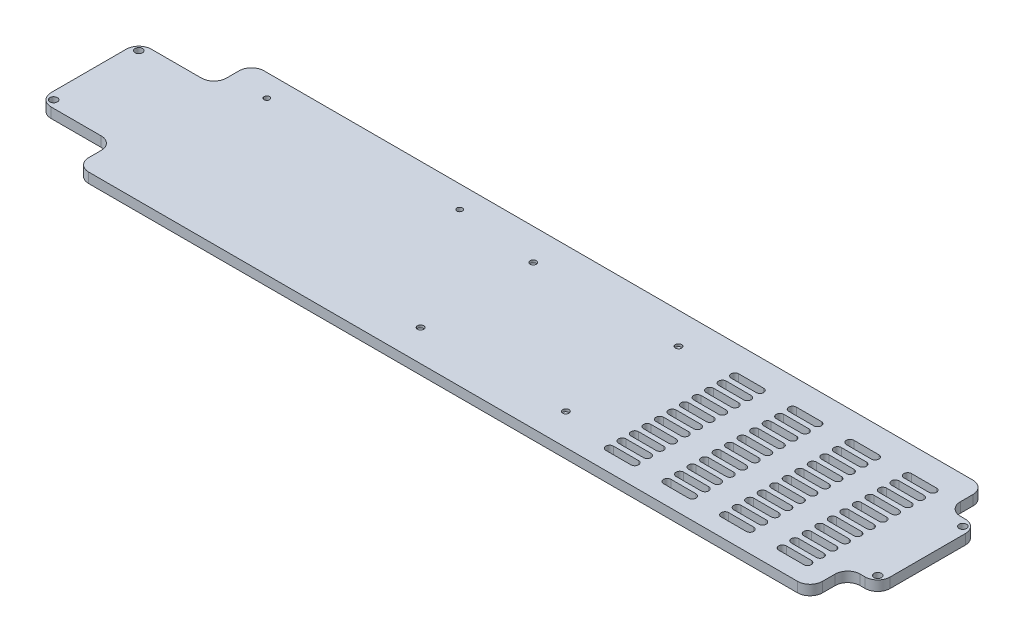
from build123d import *

# Parameters (mm, degrees)
SKETCH1_W            = 335
SKETCH1_H            = 70
EXTRUDE1_DEPTH       = 4
SKETCH2_W            = 30
SKETCH2_H            = 15
SKETCH2_W_2          = 12
EXTRUDE2_DEPTH       = 185.306017615
SKETCH4_R            = 1.1
EXTRUDE4_DEPTH       = 185.306017615
SKETCH5_R            = 1.25
EXTRUDE5_DEPTH       = 1
EXTRUDE6_DEPTH       = 185.306017615
LPATTERN1_COUNT      = 11
LPATTERN1_PITCH      = 5
LPATTERN1_COUNT_DIR2 = 4
LPATTERN1_PITCH_DIR2 = 23
FILLET1_R            = 5
SKETCH7_R            = 1.5
EXTRUDE7_DEPTH       = 185.306017615


with BuildPart() as part:
    # Sketch1 → Extrude1 (new body)
    with BuildSketch(Plane(origin=(0, 0, 0), x_dir=(1, 0, 0), z_dir=(0, 1, 0))):
        with Locations((12.647057132, 3.726553367)):
            Rectangle(SKETCH1_W, SKETCH1_H)
    extrude(amount=EXTRUDE1_DEPTH)

    # Sketch2 → Extrude2 (cut, through all)
    with BuildSketch(Plane(origin=(0, 4, 0), x_dir=(1, 0, 0), z_dir=(0, 1, 0))):
        with Locations((-139.852942868, 31.226553367)):
            Rectangle(SKETCH2_W, SKETCH2_H)
        with Locations((-139.852942868, -23.773446633)):
            Rectangle(SKETCH2_W, SKETCH2_H)
        with Locations((174.147057132, 31.226553367)):
            Rectangle(SKETCH2_W_2, SKETCH2_H)
        with Locations((174.147057132, -23.773446633)):
            Rectangle(SKETCH2_W_2, SKETCH2_H)
    extrude(amount=-EXTRUDE2_DEPTH, mode=Mode.SUBTRACT)

    # Sketch4 → Extrude4 (cut, through all)
    with BuildSketch(Plane(origin=(0, 4, 0), x_dir=(1, 0, 0), z_dir=(0, 1, 0))):
        with Locations(Location((-109.852942868, 29.826553367, 0), (0, 0, 270))):
            Circle(SKETCH4_R)
        with Locations(Location((-32.852942868, 29.826553367, 0), (0, 0, 270))):
            Circle(SKETCH4_R)
    extrude(amount=-EXTRUDE4_DEPTH, mode=Mode.SUBTRACT)

    # Sketch5 → Extrude5 (cut)
    with BuildSketch(Plane(origin=(0, 4, 0), x_dir=(1, 0, 0), z_dir=(0, 1, 0))):
        with Locations(Location((0.147057132, 26.226553367, 0), (0, 0, 270))):
            Circle(SKETCH5_R)
        with Locations(Location((0.147057132, -18.773446633, 0), (0, 0, 270))):
            Circle(SKETCH5_R)
        with Locations(Location((58.147057132, 26.226553367, 0), (0, 0, 270))):
            Circle(SKETCH5_R)
        with Locations(Location((58.147057132, -18.773446633, 0), (0, 0, 270))):
            Circle(SKETCH5_R)
    extrude(amount=-EXTRUDE5_DEPTH, mode=Mode.SUBTRACT)

    # Sketch6 → Extrude6 (cut, through all)
    with BuildSketch(Plane(origin=(0, 4, 0), x_dir=(1, 0, 0), z_dir=(0, 1, 0))):
        with BuildLine():
            Line((148.647057132, -21.273446633), (158.647057132, -21.273446633))
            ThreePointArc((158.647057132, -21.273446633), (160.147057132, -22.773446633), (158.647057132, -24.273446633))
            Line((158.647057132, -24.273446633), (148.647057132, -24.273446633))
            ThreePointArc((148.647057132, -24.273446633), (147.147057132, -22.773446633), (148.647057132, -21.273446633))
        make_face()
    extrude6 = extrude(amount=-EXTRUDE6_DEPTH, mode=Mode.SUBTRACT)

    # LPattern1: Extrude6 11 × 4
    with Locations(*[(-j * LPATTERN1_PITCH_DIR2, 0, -i * LPATTERN1_PITCH) for i in range(LPATTERN1_COUNT) for j in range(LPATTERN1_COUNT_DIR2) if (i, j) != (0, 0)]):
        add(extrude6, mode=Mode.SUBTRACT)

    # Fillet1
    fillet1_edges = [part.edges().sort_by_distance(p)[0] for p in [
        (-154.852942868, 2, 16.273446633),
        (-124.852942868, 2, 16.273446633),
        (-124.852942868, 2, 31.273446633),
        (180.147057132, 2, -23.726553367),
        (168.147057132, 2, -23.726553367),
        (168.147057132, 2, -38.726553367),
        (180.147057132, 2, 16.273446633),
        (168.147057132, 2, 31.273446633),
        (168.147057132, 2, 16.273446633),
        (-154.852942868, 2, -23.726553367),
        (-124.852942868, 2, -38.726553367),
        (-124.852942868, 2, -23.726553367),
    ]]
    fillet(fillet1_edges, radius=FILLET1_R)

    # Sketch7 → Extrude7 (cut, through all)
    with BuildSketch(Plane(origin=(0, 4, 0), x_dir=(1, 0, 0), z_dir=(0, 1, 0))):
        with Locations(Location((-151.852942868, 20.726553367, 0), (0, 0, 270))):
            Circle(SKETCH7_R)
        with Locations(Location((-151.852942868, -13.273446633, 0), (0, 0, 270))):
            Circle(SKETCH7_R)
        with Locations(Location((177.147057132, -13.273446633, 0), (0, 0, 270))):
            Circle(SKETCH7_R)
        with Locations(Location((177.147057132, 20.726553367, 0), (0, 0, 270))):
            Circle(SKETCH7_R)
    extrude(amount=-EXTRUDE7_DEPTH, mode=Mode.SUBTRACT)


solid = part.part
